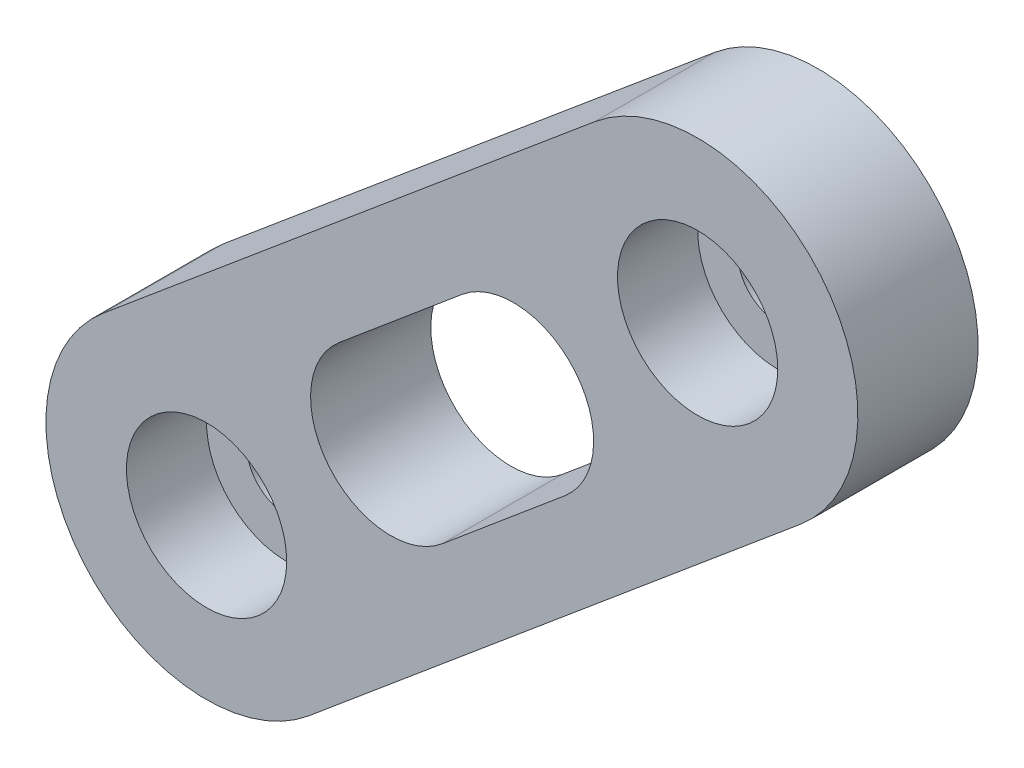
from build123d import *

# Parameters (mm, degrees)
SKETCH1_R           = 6.35
BOSS_EXTRUDE1_DEPTH = 19.05
SKETCH2_R           = 12.7
CUT_EXTRUDE1_DEPTH  = 12.7


with BuildPart() as part:
    # Sketch1 → Boss-Extrude1 (new body)
    with BuildSketch(Plane.XY):
        with BuildLine():
            Line((416.097857399, 375.438123066), (338.203539729, 310.207612774))
            ThreePointArc((338.203539729, 310.207612774), (335.037590149, 274.426379512), (370.818823143, 271.260426896))
            Line((370.818823143, 271.260426896), (448.713137508, 336.490934421))
            ThreePointArc((448.713137508, 336.490934421), (451.879091776, 372.272168799), (416.097857399, 375.438123066))
        make_face()
        with Locations(Location((354.575405538, 290.657327323, 0), (0, 0, 180))):
            Circle(SKETCH1_R, mode=Mode.SUBTRACT)
        with Locations(Location((432.405497453, 355.964528744, 0), (0, 0, 180))):
            Circle(SKETCH1_R, mode=Mode.SUBTRACT)
        with BuildLine():
            Line((411.382606814, 321.745556387), (391.925077958, 305.418751101))
            ThreePointArc((391.925077958, 305.418751101), (374.032910888, 306.984112886), (375.598272672, 324.876279956))
            Line((375.598272672, 324.876279956), (395.055801528, 341.203085243))
            ThreePointArc((395.055801528, 341.203085243), (412.947968598, 339.637723458), (411.382606814, 321.745556387))
        make_face(mode=Mode.SUBTRACT)
    extrude(amount=BOSS_EXTRUDE1_DEPTH)

    # Sketch2 → Cut-Extrude1 (cut)
    with BuildSketch(Plane.XY.offset(19.05)):
        with Locations((354.575405538, 290.657327323)):
            Circle(SKETCH2_R)
        with Locations((432.405497453, 355.964528744)):
            Circle(SKETCH2_R)
    extrude(amount=-CUT_EXTRUDE1_DEPTH, mode=Mode.SUBTRACT)


solid = part.part
